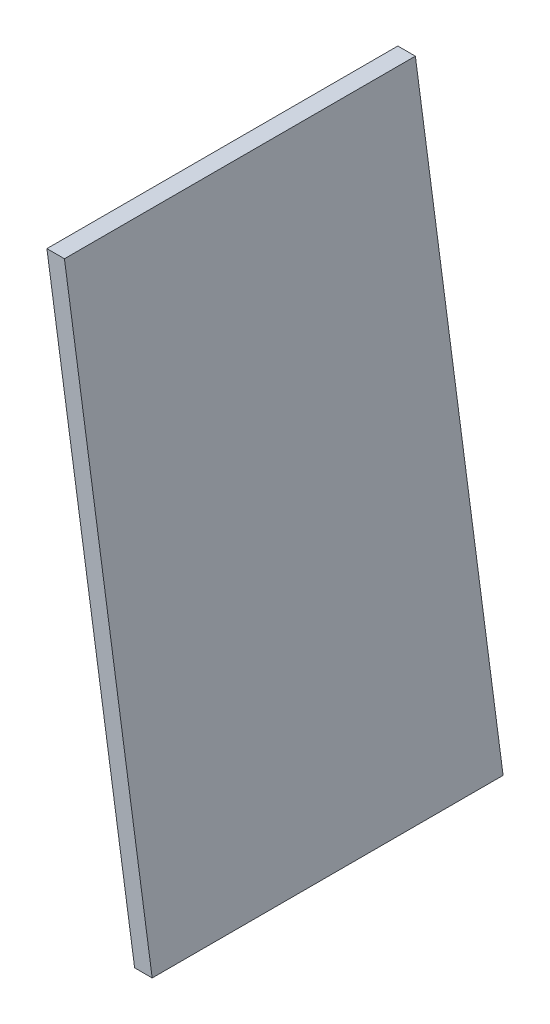
from build123d import *

# Parameters (mm, degrees)
SALIENTE_EXTRUIR1_DEPTH = 100


with BuildPart() as part:
    # Croquis1 → Saliente-Extruir1 (new, symmetric)
    with BuildSketch(Plane.XY):
        Polygon((0, 0), (-10, 0), (-60, 330), (-50, 330), align=None)
    extrude(amount=SALIENTE_EXTRUIR1_DEPTH, both=True)


solid = part.part
